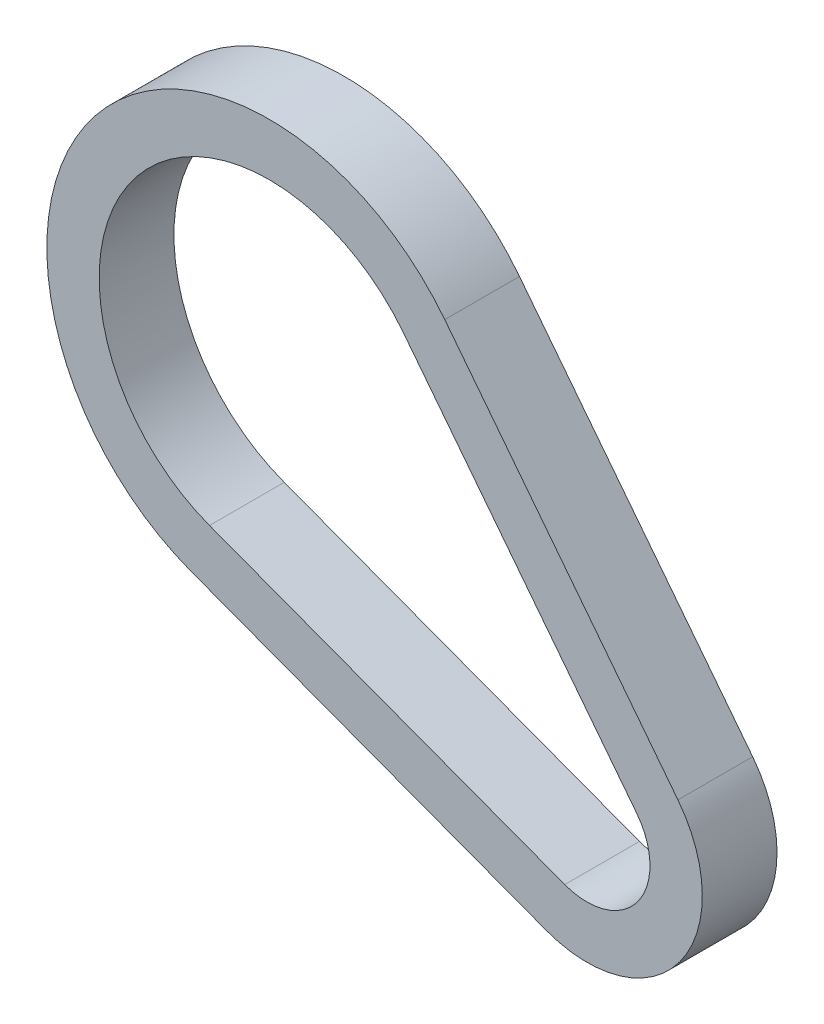
from build123d import *

# Parameters (mm, degrees)
EXTRUDE_THIN1_DEPTH = 6.35


with BuildPart() as part:
    # Sketch2 → Extrude-Thin1 (new, symmetric)
    with BuildSketch(Plane.XY):
        with BuildLine():
            Line((47.085845471, -59.314078842), (-13.281736911, -36.655405278))
            ThreePointArc((-13.281736911, -36.655405278), (-30.449676725, 21.120815737), (29.817497558, 21.95602595))
            Line((29.817497558, 21.95602595), (69.44115098, -28.912693121))
            ThreePointArc((69.44115098, -28.912693121), (69.769058392, -52.573865873), (47.085845471, -59.314078842))
        make_face()
        with BuildLine():
            Line((50.209850559, -50.991057023), (-10.157731823, -28.332383458))
            ThreePointArc((-10.157731823, -28.332383458), (-23.287590498, 15.854258904), (22.804106561, 16.493018835))
            Line((22.804106561, 16.493018835), (62.427759983, -34.375700235))
            ThreePointArc((62.427759983, -34.375700235), (62.606972164, -47.30730904), (50.209850559, -50.991057023))
        make_face(mode=Mode.SUBTRACT)
    extrude(amount=EXTRUDE_THIN1_DEPTH, both=True)


solid = part.part
